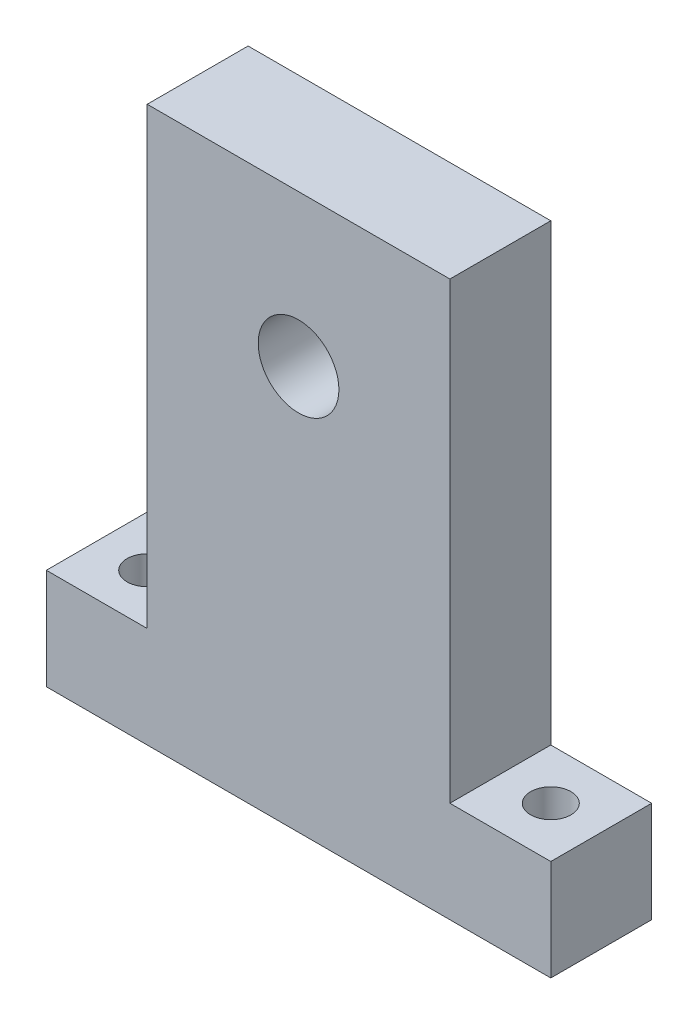
from build123d import *

# Parameters (mm, degrees)
SKETCH1_W           = 50
SKETCH1_H           = 10
SKETCH1_R           = 2
BOSS_EXTRUDE1_DEPTH = 10
SKETCH4_W           = 30
SKETCH4_H           = 10
BOSS_EXTRUDE3_DEPTH = 45
SKETCH5_R           = 4
CUT_EXTRUDE1_DEPTH  = 45


with BuildPart() as part:
    # Sketch1 → Boss-Extrude1 (new body)
    with BuildSketch(Plane(origin=(0, 0, 0), x_dir=(1, 0, 0), z_dir=(0, 1, 0))):
        Rectangle(SKETCH1_W, SKETCH1_H)
        with Locations(Location((-20, 0, 0), (0, 0, 270))):
            Circle(SKETCH1_R, mode=Mode.SUBTRACT)
        with Locations(Location((20, 0, 0), (0, 0, 270))):
            Circle(SKETCH1_R, mode=Mode.SUBTRACT)
    extrude(amount=BOSS_EXTRUDE1_DEPTH)

    # Sketch4 → Boss-Extrude3 (add)
    with BuildSketch(Plane(origin=(0, 10, 0), x_dir=(1, 0, 0), z_dir=(0, 1, 0))):
        Rectangle(SKETCH4_W, SKETCH4_H)
    extrude(amount=BOSS_EXTRUDE3_DEPTH)

    # Sketch5 → Cut-Extrude1 (cut)
    with BuildSketch(Plane.XY.offset(5)):
        with Locations((0, 40)):
            Circle(SKETCH5_R)
    extrude(amount=-CUT_EXTRUDE1_DEPTH, mode=Mode.SUBTRACT)


solid = part.part
